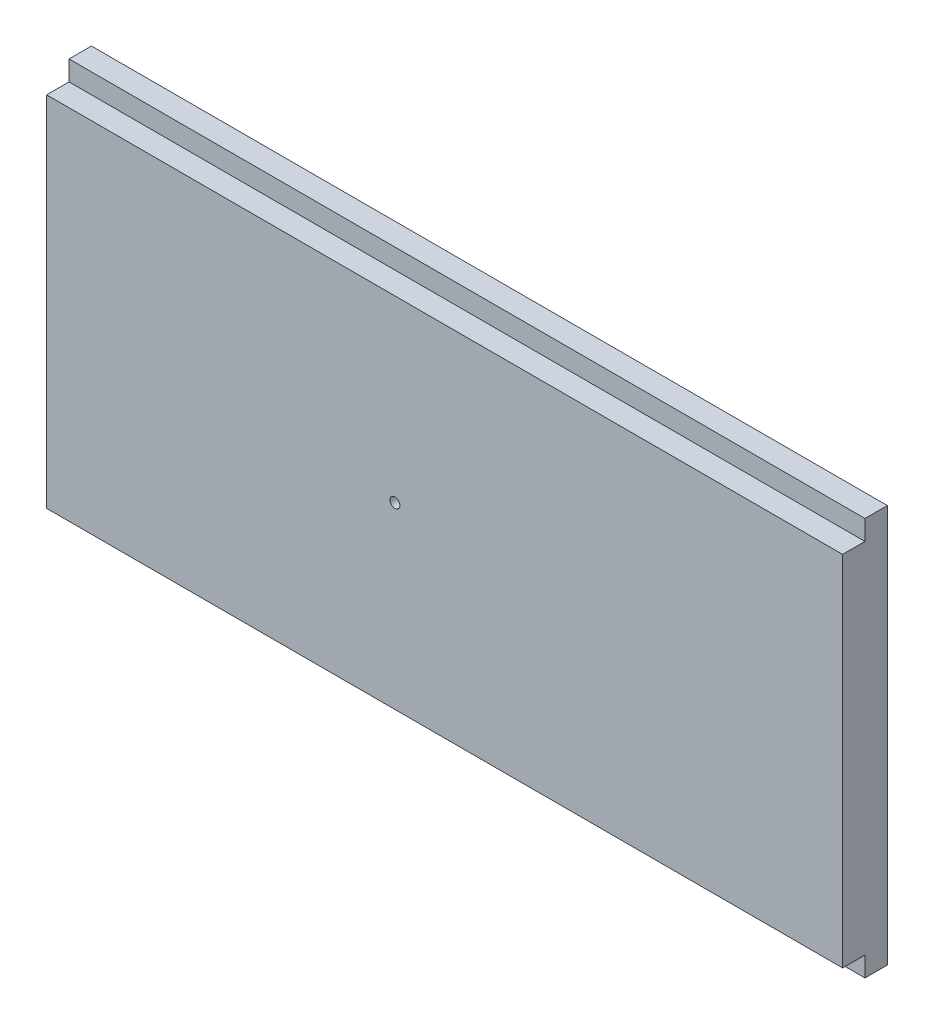
from build123d import *

# Parameters (mm, degrees)
SKETCH1_W           = 40
SKETCH1_H           = 80
BOSS_EXTRUDE1_DEPTH = 4.5
SKETCH2_R           = 0.5
CUT_EXTRUDE1_DEPTH  = 90.555848497
SKETCH3_W           = 2
SKETCH3_H           = 2.25
CUT_EXTRUDE2_DEPTH  = 90.555848497


with BuildPart() as part:
    # Sketch1 → Boss-Extrude1 (new body)
    with BuildSketch(Plane(origin=(0, 0, 0), x_dir=(0, 1, 0), z_dir=(0, 0, 1))):
        with Locations((20, 40)):
            Rectangle(SKETCH1_W, SKETCH1_H)
    extrude(amount=BOSS_EXTRUDE1_DEPTH)

    # Sketch2 → Cut-Extrude1 (cut, through all)
    with BuildSketch(Plane.XY.offset(4.5)):
        with Locations((-45, 20)):
            Circle(SKETCH2_R)
    extrude(amount=-CUT_EXTRUDE1_DEPTH, mode=Mode.SUBTRACT)

    # Sketch3 → Cut-Extrude2 (cut, through all)
    with BuildSketch(Plane(origin=(-80, 0, 0), x_dir=(0, -1, 0), z_dir=(-1, 0, 0))):
        with Locations((-39, 3.375)):
            Rectangle(SKETCH3_W, SKETCH3_H)
        with Locations((-1, 3.375)):
            Rectangle(SKETCH3_W, SKETCH3_H)
    extrude(amount=-CUT_EXTRUDE2_DEPTH, mode=Mode.SUBTRACT)


solid = part.part
